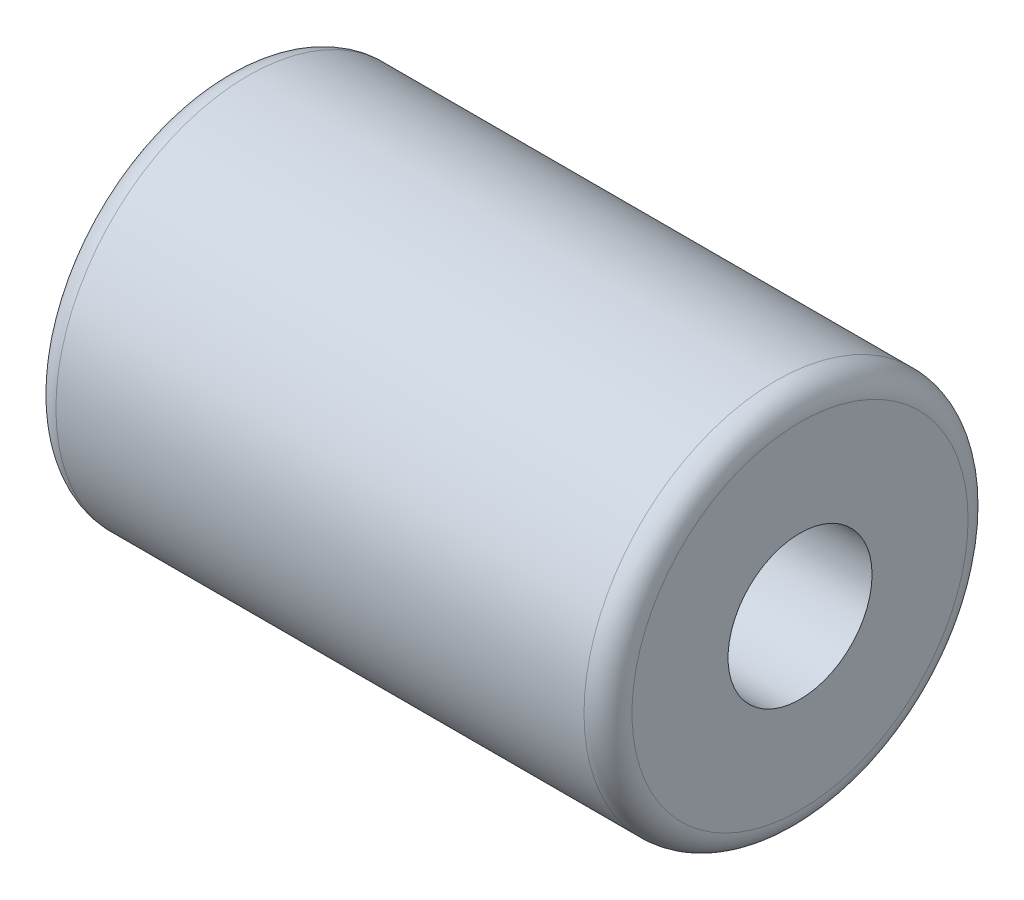
from build123d import *

# Parameters (mm, degrees)
CROQUIS1_R              = 4
CROQUIS1_R_2            = 1.5
SALIENTE_EXTRUIR1_DEPTH = 12
REDONDEO1_R             = 0.5


with BuildPart() as part:
    # Croquis1 → Saliente-Extruir1 (new body)
    with BuildSketch(Plane(origin=(0, 0, 0), x_dir=(0, 0, -1), z_dir=(1, 0, 0))):
        Circle(CROQUIS1_R)
        Circle(CROQUIS1_R_2, mode=Mode.SUBTRACT)
    extrude(amount=SALIENTE_EXTRUIR1_DEPTH)

    # Redondeo1
    redondeo1_edges = [part.edges().sort_by_distance(p)[0] for p in [
        (0, 0, 4),
        (12, 0, 4),
    ]]
    fillet(redondeo1_edges, radius=REDONDEO1_R)


solid = part.part
